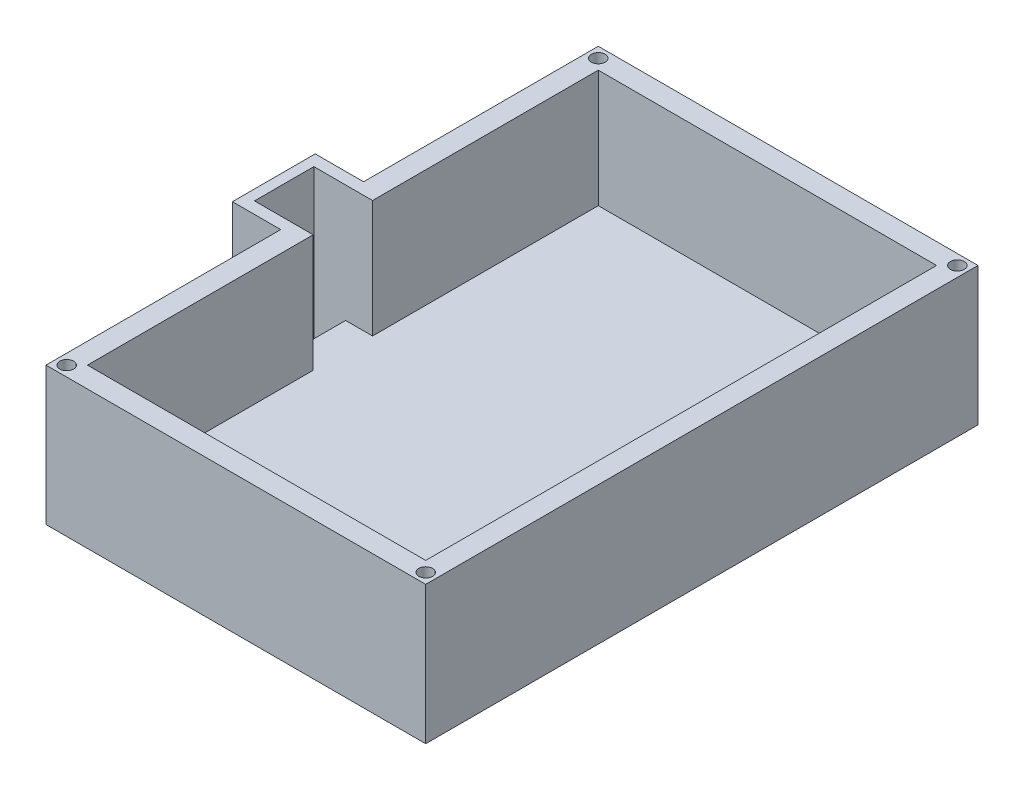
from build123d import *

# Parameters (mm, degrees)
SKETCH1_W               = 55
SKETCH1_H               = 80
BOSS_EXTRUDE1_DEPTH     = 20
SKETCH2_W               = 49
SKETCH2_H               = 74
CUT_EXTRUDE1_DEPTH      = 17
SKETCH4_W               = 16
SKETCH4_H               = 12
BOSS_EXTRUDE2_DEPTH     = 40
SKETCH6_W               = 18
SKETCH6_H               = 20
CUT_EXTRUDE2_DEPTH      = 43
SKETCH5_W               = 5
SKETCH5_H               = 4
CUT_EXTRUDE3_DEPTH      = 15
SKETCH7_W               = 4.6
SKETCH7_H               = 8.6
CUT_EXTRUDE6_DEPTH      = 34
SKETCH9_W               = 3.9
SKETCH9_H               = 8.6
CUT_EXTRUDE7_DEPTH      = 17
SKETCH10_R              = 1
CUT_EXTRUDE8_DEPTH      = 3
SKETCH13_W              = 7
SKETCH13_H              = 18
BOSS_EXTRUDE3_DEPTH     = 7
CUT_EXTRUDE9_DEPTH      = 3
CUT_EXTRUDE9_DEPTH_BACK = 9
SKETCH14_W              = 12
SKETCH14_H              = 2


with BuildPart() as part:
    # Sketch1 → Boss-Extrude1 (new body)
    with BuildSketch(Plane(origin=(0, 0, 0), x_dir=(1, 0, 0), z_dir=(0, 1, 0))):
        Rectangle(SKETCH1_W, SKETCH1_H)
    extrude(amount=BOSS_EXTRUDE1_DEPTH)

    # Sketch2 → Cut-Extrude1 (cut)
    with BuildSketch(Plane(origin=(0, 20, 0), x_dir=(1, 0, 0), z_dir=(0, 1, 0))):
        Rectangle(SKETCH2_W, SKETCH2_H)
    extrude(amount=-CUT_EXTRUDE1_DEPTH, mode=Mode.SUBTRACT)

    # Sketch4 → Boss-Extrude2 (add)
    with BuildSketch(Plane(origin=(0, 20, 0), x_dir=(1, 0, 0), z_dir=(0, 1, 0))):
        with Locations((-35.5, 0)):
            Rectangle(SKETCH4_W, SKETCH4_H)
    extrude(amount=-BOSS_EXTRUDE2_DEPTH)

    # Sketch6 → Cut-Extrude2 (cut)
    with BuildSketch(Plane(origin=(0, 20, 0), x_dir=(1, 0, 0), z_dir=(0, 1, 0))):
        with Locations((-43.5, 0)):
            Rectangle(SKETCH6_W, SKETCH6_H)
    extrude(amount=-CUT_EXTRUDE2_DEPTH, mode=Mode.SUBTRACT)

    # Sketch5 → Cut-Extrude3 (cut)
    with BuildSketch(Plane.ZY.offset(43.5)):
        with Locations((0, -15)):
            Rectangle(SKETCH5_W, SKETCH5_H)
    extrude(amount=-CUT_EXTRUDE3_DEPTH, mode=Mode.SUBTRACT)

    # Sketch7 → Cut-Extrude6 (cut)
    with BuildSketch(Plane(origin=(0, 20, 0), x_dir=(1, 0, 0), z_dir=(0, 1, 0))):
        with Locations((-30.7, 0)):
            Rectangle(SKETCH7_W, SKETCH7_H)
    extrude(amount=-CUT_EXTRUDE6_DEPTH, mode=Mode.SUBTRACT)

    # Sketch9 → Cut-Extrude7 (cut)
    with BuildSketch(Plane(origin=(0, 20, 0), x_dir=(1, 0, 0), z_dir=(0, 1, 0))):
        with Locations((-26.45, 0)):
            Rectangle(SKETCH9_W, SKETCH9_H)
    extrude(amount=-CUT_EXTRUDE7_DEPTH, mode=Mode.SUBTRACT)

    # Sketch10 → Cut-Extrude8 (cut)
    with BuildSketch(Plane(origin=(0, 20, 0), x_dir=(1, 0, 0), z_dir=(0, 1, 0))):
        with Locations(Location((-26, -38.5, 0), (0, 0, 270))):
            Circle(SKETCH10_R)
        with Locations(Location((26, -38.5, 0), (0, 0, 270))):
            Circle(SKETCH10_R)
        with Locations(Location((26, 38.5, 0), (0, 0, 270))):
            Circle(SKETCH10_R)
        with Locations(Location((-26, 38.5, 0), (0, 0, 270))):
            Circle(SKETCH10_R)
    extrude(amount=-CUT_EXTRUDE8_DEPTH, mode=Mode.SUBTRACT)

    # Sketch13 → Boss-Extrude3 (add)
    with BuildSketch(Plane(origin=(0, 0, 0), x_dir=(-1, 0, 0), z_dir=(0, -1, 0))):
        with Locations((0, 20)):
            Rectangle(SKETCH13_W, SKETCH13_H)
        with Locations((0, -20)):
            Rectangle(SKETCH13_W, SKETCH13_H)
    extrude(amount=BOSS_EXTRUDE3_DEPTH)

    # Sketch14 → Cut-Extrude9 (cut, two sides: drawn at the far end of the back side and taken through both)
    with BuildSketch(Plane.ZY.offset(3.5).offset(-CUT_EXTRUDE9_DEPTH_BACK)):
        with Locations((-20, -3.5)):
            Rectangle(SKETCH14_W, SKETCH14_H)
        with Locations((20, -3.5)):
            Rectangle(SKETCH14_W, SKETCH14_H)
    extrude(amount=CUT_EXTRUDE9_DEPTH + CUT_EXTRUDE9_DEPTH_BACK, mode=Mode.SUBTRACT)


solid = part.part
